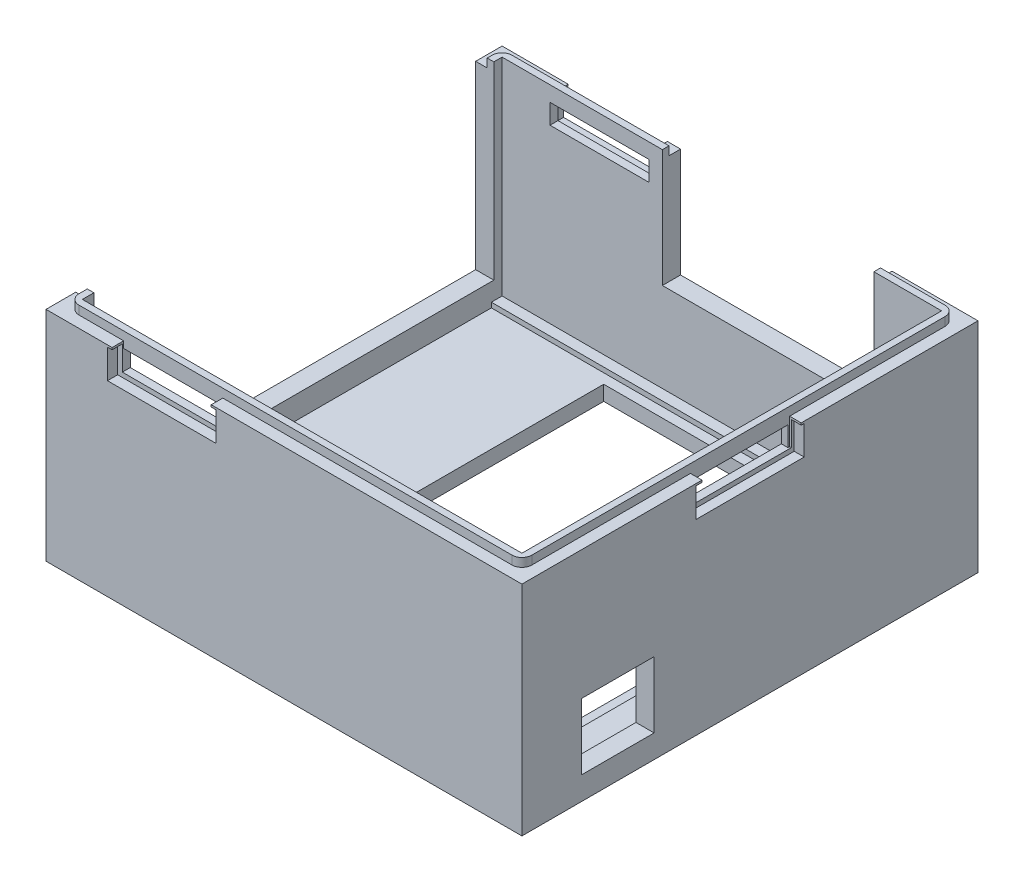
from build123d import *

# Parameters (mm, degrees)
SKETCH2_W           = 66.5
SKETCH2_H           = 63.5
BOSS_EXTRUDE1_DEPTH = 3
SKETCH3_W           = 62.5
SKETCH3_H           = 60.25
CUT_EXTRUDE1_DEPTH  = 0.75
SKETCH4_W           = 42
SKETCH4_H           = 56.75
CUT_EXTRUDE2_DEPTH  = 47.029202687
SKETCH6_W           = 72
SKETCH6_H           = 69
SKETCH6_W_2         = 66.5
SKETCH6_H_2         = 63.5
BOSS_EXTRUDE2_DEPTH = 33
SKETCH7_W           = 60.5
SKETCH7_H           = 30
CUT_EXTRUDE3_DEPTH  = 30
SKETCH8_W           = 11
SKETCH8_H           = 10
CUT_EXTRUDE4_DEPTH  = 3
SKETCH10_W          = 32
SKETCH10_H          = 16.5
CUT_EXTRUDE5_DEPTH  = 16.5
BOSS_EXTRUDE3_DEPTH = 1.3
SKETCH12_W          = 15
SKETCH12_H          = 3
CUT_EXTRUDE6_DEPTH  = 86.049926514
SKETCH13_W          = 15
SKETCH13_H          = 3
CUT_EXTRUDE7_DEPTH  = 3
SKETCH14_W          = 16.4
SKETCH14_H          = 4.4
SKETCH14_W_2        = 15
SKETCH14_H_2        = 3
CUT_EXTRUDE9_DEPTH  = 1.55
SKETCH15_W          = 15
SKETCH15_H          = 1.75
CUT_EXTRUDE10_DEPTH = 4
SKETCH17_W          = 16.4
SKETCH17_H          = 4.4
SKETCH17_W_2        = 15
SKETCH17_H_2        = 3
CUT_EXTRUDE12_DEPTH = 1.5
SKETCH16_W          = 1.75
SKETCH16_H          = 15
CUT_EXTRUDE11_DEPTH = 4
SKETCH18_W          = 28
SKETCH18_H          = 3
CUT_EXTRUDE13_DEPTH = 3
SKETCH20_W          = 2.75
SKETCH20_H          = 60.5
BOSS_EXTRUDE4_DEPTH = 2.7


with BuildPart() as part:
    # Sketch2 → Boss-Extrude1 (new body)
    with BuildSketch(Plane(origin=(0, 0, 0), x_dir=(1, 0, 0), z_dir=(0, 1, 0))):
        Rectangle(SKETCH2_W, SKETCH2_H)
    extrude(amount=BOSS_EXTRUDE1_DEPTH)

    # Sketch3 → Cut-Extrude1 (cut)
    with BuildSketch(Plane(origin=(0, 3, 0), x_dir=(1, 0, 0), z_dir=(0, 1, 0))):
        with Locations((-2, 0)):
            Rectangle(SKETCH3_W, SKETCH3_H)
    extrude(amount=-CUT_EXTRUDE1_DEPTH, mode=Mode.SUBTRACT)

    # Sketch4 → Cut-Extrude2 (cut, through all)
    with BuildSketch(Plane(origin=(0, 2.25, 0), x_dir=(1, 0, 0), z_dir=(0, 1, 0))):
        with Locations((6.25, 0.25)):
            Rectangle(SKETCH4_W, SKETCH4_H)
    extrude(amount=-CUT_EXTRUDE2_DEPTH, mode=Mode.SUBTRACT)

    # Sketch6 → Boss-Extrude2 (add)
    with BuildSketch(Plane(origin=(0, 0, 0), x_dir=(1, 0, 0), z_dir=(0, 1, 0))):
        Rectangle(SKETCH6_W, SKETCH6_H)
        Rectangle(SKETCH6_W_2, SKETCH6_H_2, mode=Mode.SUBTRACT)
    extrude(amount=BOSS_EXTRUDE2_DEPTH)

    # Sketch7 → Cut-Extrude3 (cut)
    with BuildSketch(Plane.ZY.offset(36)):
        with Locations((-0.25, 18)):
            Rectangle(SKETCH7_W, SKETCH7_H)
    extrude(amount=-CUT_EXTRUDE3_DEPTH, mode=Mode.SUBTRACT)

    # Sketch8 → Cut-Extrude4 (cut)
    with BuildSketch(Plane(origin=(36, 0, 0), x_dir=(0, 0, -1), z_dir=(1, 0, 0))):
        with Locations((-20, 8.5)):
            Rectangle(SKETCH8_W, SKETCH8_H)
    extrude(amount=-CUT_EXTRUDE4_DEPTH, mode=Mode.SUBTRACT)

    # Sketch10 → Cut-Extrude5 (cut)
    with BuildSketch(Plane(origin=(0, 0, -34.5), x_dir=(-1, 0, 0), z_dir=(0, 0, -1))):
        with Locations((-7, 24.75)):
            Rectangle(SKETCH10_W, SKETCH10_H)
    extrude(amount=-CUT_EXTRUDE5_DEPTH, mode=Mode.SUBTRACT)

    # Sketch11 → Boss-Extrude3 (add)
    with BuildSketch(Plane(origin=(0, 33, 0), x_dir=(1, 0, 0), z_dir=(0, 1, 0))):
        with BuildLine():
            Line((-34.25, 31.25), (-34.25, 30.5))
            Line((-34.25, 30.5), (-33.25, 30.5))
            Line((-33.25, 30.5), (-33.25, 31.75))
            Line((-33.25, 31.75), (-9, 31.75))
            Line((-9, 31.75), (-9, 32.75))
            Line((-9, 32.75), (-32.75, 32.75))
            ThreePointArc((-32.75, 32.75), (-33.810660172, 32.310660172), (-34.25, 31.25))
        make_face()
        with BuildLine():
            Line((-33.25, -31.75), (33.25, -31.75))
            Line((33.25, -31.75), (33.25, 31.75))
            Line((33.25, 31.75), (23, 31.75))
            Line((23, 31.75), (23, 32.75))
            Line((23, 32.75), (32.75, 32.75))
            ThreePointArc((32.75, 32.75), (33.810660172, 32.310660172), (34.25, 31.25))
            Line((34.25, 31.25), (34.25, -31.25))
            ThreePointArc((34.25, -31.25), (33.810660172, -32.310660172), (32.75, -32.75))
            Line((32.75, -32.75), (-32.75, -32.75))
            ThreePointArc((-32.75, -32.75), (-33.810660172, -32.310660172), (-34.25, -31.25))
            Line((-34.25, -31.25), (-34.25, -30))
            Line((-34.25, -30), (-33.25, -30))
            Line((-33.25, -30), (-33.25, -31.75))
        make_face()
    extrude(amount=BOSS_EXTRUDE3_DEPTH)

    # Sketch12 → Cut-Extrude6 (cut, through all)
    with BuildSketch(Plane.XY.offset(34.5)):
        with Locations((-18.5, 30.5)):
            Rectangle(SKETCH12_W, SKETCH12_H)
    extrude(amount=-CUT_EXTRUDE6_DEPTH, mode=Mode.SUBTRACT)

    # Sketch13 → Cut-Extrude7 (cut)
    with BuildSketch(Plane(origin=(36, 0, 0), x_dir=(0, 0, -1), z_dir=(1, 0, 0))):
        with Locations((0, 30.5)):
            Rectangle(SKETCH13_W, SKETCH13_H)
    extrude(amount=-CUT_EXTRUDE7_DEPTH, mode=Mode.SUBTRACT)

    # Sketch14 → Cut-Extrude9 (cut)
    with BuildSketch(Plane.XY.offset(34.5)):
        with Locations((-18.5, 30.5)):
            Rectangle(SKETCH14_W, SKETCH14_H)
        with Locations((-18.5, 30.5)):
            Rectangle(SKETCH14_W_2, SKETCH14_H_2, mode=Mode.SUBTRACT)
    cut_extrude9 = extrude(amount=-CUT_EXTRUDE9_DEPTH, mode=Mode.SUBTRACT)

    # Sketch15 → Cut-Extrude10 (cut)
    with BuildSketch(Plane(origin=(0, 33, 0), x_dir=(1, 0, 0), z_dir=(0, 1, 0))):
        with Locations((-18.5, -33.625)):
            Rectangle(SKETCH15_W, SKETCH15_H)
    cut_extrude10 = extrude(amount=-CUT_EXTRUDE10_DEPTH, mode=Mode.SUBTRACT)

    # Mirror1: Cut-Extrude9, Cut-Extrude10 across plane
    add(cut_extrude9.mirror(Plane.XY), mode=Mode.SUBTRACT)
    add(cut_extrude10.mirror(Plane.XY), mode=Mode.SUBTRACT)

    # Sketch17 → Cut-Extrude12 (cut)
    with BuildSketch(Plane(origin=(36, 0, 0), x_dir=(0, 0, -1), z_dir=(1, 0, 0))):
        with Locations((0, 30.5)):
            Rectangle(SKETCH17_W, SKETCH17_H)
        with Locations((0, 30.5)):
            Rectangle(SKETCH17_W_2, SKETCH17_H_2, mode=Mode.SUBTRACT)
    extrude(amount=-CUT_EXTRUDE12_DEPTH, mode=Mode.SUBTRACT)

    # Sketch16 → Cut-Extrude11 (cut)
    with BuildSketch(Plane(origin=(0, 33, 0), x_dir=(1, 0, 0), z_dir=(0, 1, 0))):
        with Locations((35.125, 0.25)):
            Rectangle(SKETCH16_W, SKETCH16_H)
    extrude(amount=-CUT_EXTRUDE11_DEPTH, mode=Mode.SUBTRACT)

    # Sketch18 → Cut-Extrude13 (cut)
    with BuildSketch(Plane.XZ):
        with Locations((6.25, 29.625)):
            Rectangle(SKETCH18_W, SKETCH18_H)
    extrude(amount=-CUT_EXTRUDE13_DEPTH, mode=Mode.SUBTRACT)

    # Sketch20 → Boss-Extrude4 (add)
    with BuildSketch(Plane(origin=(0, 3, 0), x_dir=(1, 0, 0), z_dir=(0, 1, 0))):
        with Locations((-34.625, 0.25)):
            Rectangle(SKETCH20_W, SKETCH20_H)
    extrude(amount=BOSS_EXTRUDE4_DEPTH)


solid = part.part
